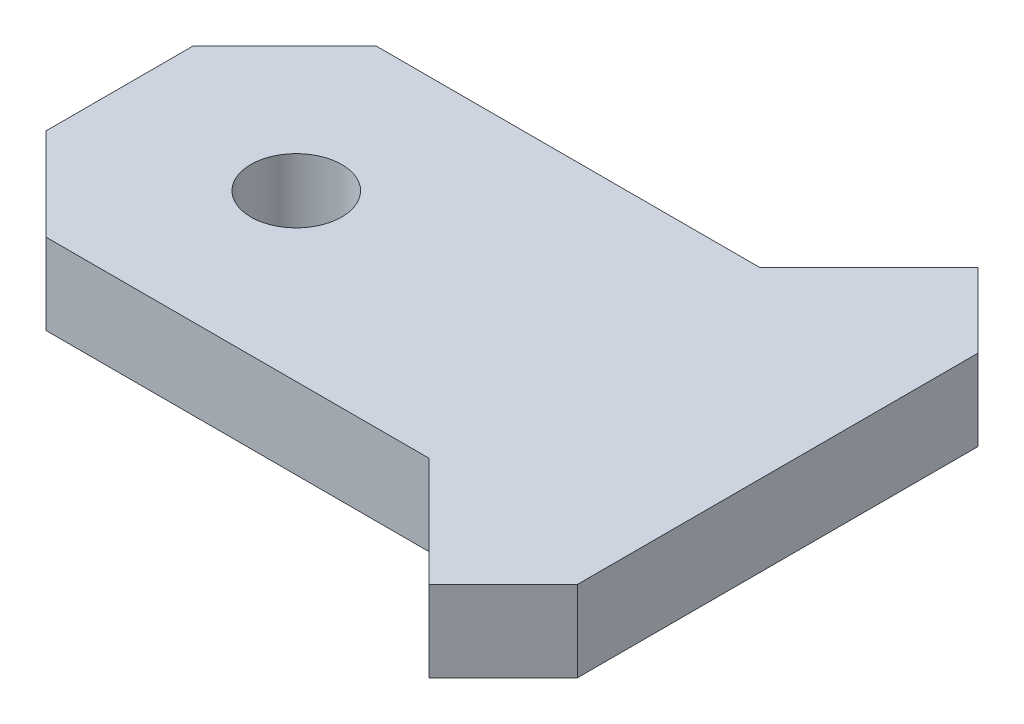
from build123d import *

# Parameters (mm, degrees)
SKETCH1_R           = 2.25
BOSS_EXTRUDE1_DEPTH = 4


with BuildPart() as part:
    # Sketch1 → Boss-Extrude1 (new body)
    with BuildSketch(Plane(origin=(0, 0, 0), x_dir=(1, 0, 0), z_dir=(0, 1, 0))):
        Polygon((0, 3.624368671), (0, -3.624368671), (4.547968979, -8.17233765), (23.47528137, -8.17233765), (23.48528137, -8.18233765), (24.05294372, -8.75), (28.879393916, -13.576450196), (32.556349179, -9.899494934), (32.556349179, 9.899494934), (28.879393916, 13.576450196), (24.05294372, 8.75), (23.48528137, 8.18233765), (23.47528137, 8.17233765), (4.547968979, 8.17233765), align=None)
        with Locations(Location((8.75, 0, 0), (0, 0, 270))):
            Circle(SKETCH1_R, mode=Mode.SUBTRACT)
    extrude(amount=BOSS_EXTRUDE1_DEPTH)


solid = part.part
